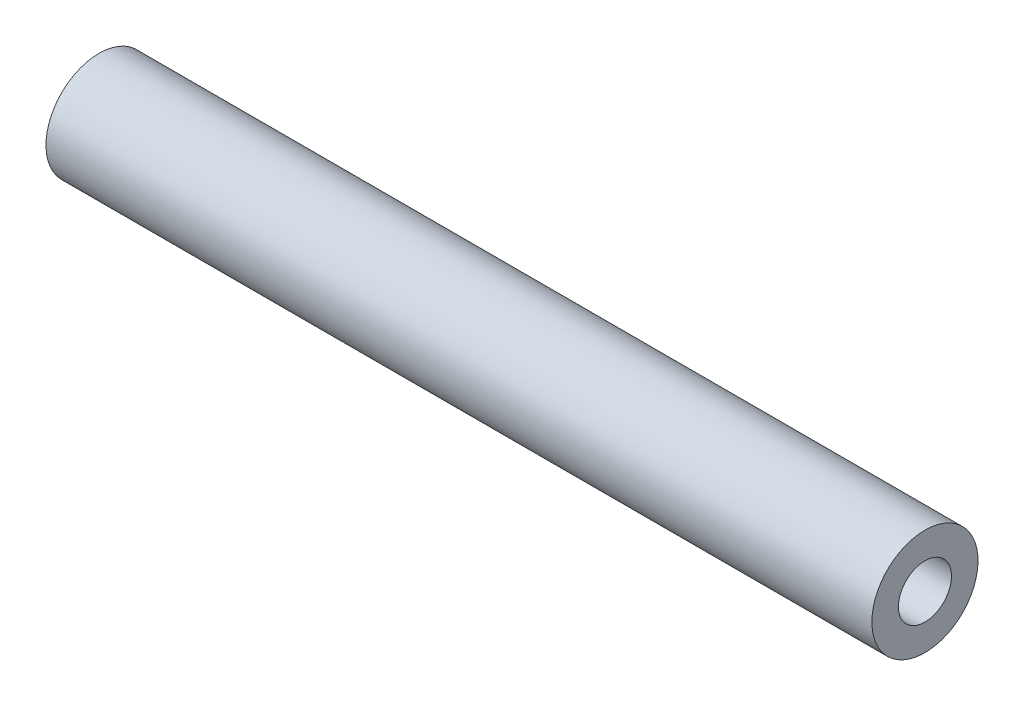
from build123d import *


with BuildPart() as part:
    # Sketch1 → Revolve1 (revolve)
    with BuildSketch(Plane.XY):
        Polygon((0, 3.175), (0, 6.35), (98.806, 6.35), (98.806, 3.175), (86.106, 3.175), (86.106, 0), (12.7, 0), (12.7, 3.175), align=None)
    revolve(axis=Axis((86.106, 0, 0), (-1, 0, 0)))


solid = part.part
